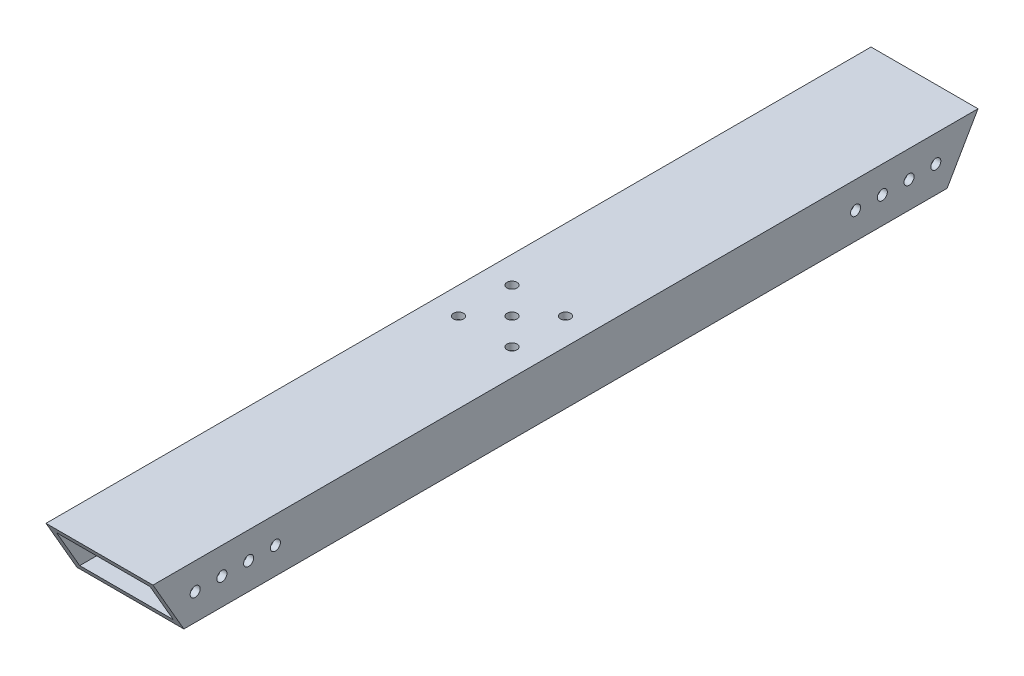
from build123d import *

# Parameters (mm, degrees)
SKETCH1_W           = 50.8
SKETCH1_H           = 25.4
SKETCH1_W_2         = 44.45
SKETCH1_H_2         = 19.05
BOSS_EXTRUDE1_DEPTH = 391.786872
CUT_EXTRUDE1_DEPTH  = 457.2
SKETCH3_R           = 2.38125
CUT_EXTRUDE2_DEPTH  = 394.430137472
SKETCH4_R           = 2.38125
CUT_EXTRUDE3_DEPTH  = 3.175
SKETCH5_R           = 2.38125
CUT_EXTRUDE4_DEPTH  = 396.270645345


with BuildPart() as part:
    # Sketch1 → Boss-Extrude1 (new body)
    with BuildSketch(Plane.XY):
        Rectangle(SKETCH1_W, SKETCH1_H)
        Rectangle(SKETCH1_W_2, SKETCH1_H_2, mode=Mode.SUBTRACT)
    extrude(amount=BOSS_EXTRUDE1_DEPTH)

    # Sketch2 → Cut-Extrude1 (cut)
    with BuildSketch(Plane(origin=(25.4, 0, 0), x_dir=(0, 0, -1), z_dir=(1, 0, 0))):
        Polygon((0, 12.7), (-14.664696837, -12.7), (0, -12.7), align=None)
        Polygon((-391.786872, -12.7), (-391.786872, 12.7), (-377.122175163, -12.7), align=None)
    extrude(amount=-CUT_EXTRUDE1_DEPTH, mode=Mode.SUBTRACT)

    # Sketch3 → Cut-Extrude2 (cut, through all)
    with BuildSketch(Plane(origin=(0, -12.7, 0), x_dir=(-1, 0, 0), z_dir=(0, -1, 0))):
        with Locations(Location((0, -195.893436, 0), (0, 0, 90))):
            Circle(SKETCH3_R)
        with Locations(Location((-12.7, -208.593436, 0), (0, 0, 90))):
            Circle(SKETCH3_R)
        with Locations(Location((12.7, -208.593436, 0), (0, 0, 90))):
            Circle(SKETCH3_R)
        with Locations(Location((-12.7, -183.193436, 0), (0, 0, 90))):
            Circle(SKETCH3_R)
        with Locations(Location((12.7, -183.193436, 0), (0, 0, 90))):
            Circle(SKETCH3_R)
    extrude(amount=-CUT_EXTRUDE2_DEPTH, mode=Mode.SUBTRACT)

    # Sketch4 → Cut-Extrude3 (cut)
    with BuildSketch(Plane.ZY.offset(25.4)):
        with Locations((195.893436, 0)):
            Circle(SKETCH4_R)
        with Locations((208.593436, 0)):
            Circle(SKETCH4_R)
        with Locations(Location((183.193436, 0, 0), (0, 0, 180))):
            Circle(SKETCH4_R)
    extrude(amount=-CUT_EXTRUDE3_DEPTH, mode=Mode.SUBTRACT)

    # Sketch5 → Cut-Extrude4 (cut, through all)
    with BuildSketch(Plane(origin=(25.4, 0, 0), x_dir=(0, 0, -1), z_dir=(1, 0, 0))):
        with Locations((-371.754523581, 0)):
            Circle(SKETCH5_R)
        with Locations((-359.054523581, 0)):
            Circle(SKETCH5_R)
        with Locations((-346.354523581, 0)):
            Circle(SKETCH5_R)
        with Locations((-333.654523581, 0)):
            Circle(SKETCH5_R)
        with Locations(Location((-58.132348419, 0, 0), (0, 0, 270))):
            Circle(SKETCH5_R)
        with Locations(Location((-45.432348419, 0, 0), (0, 0, 270))):
            Circle(SKETCH5_R)
        with Locations(Location((-32.732348419, 0, 0), (0, 0, 270))):
            Circle(SKETCH5_R)
        with Locations(Location((-20.032348419, 0, 0), (0, 0, 270))):
            Circle(SKETCH5_R)
    extrude(amount=-CUT_EXTRUDE4_DEPTH, mode=Mode.SUBTRACT)


solid = part.part
